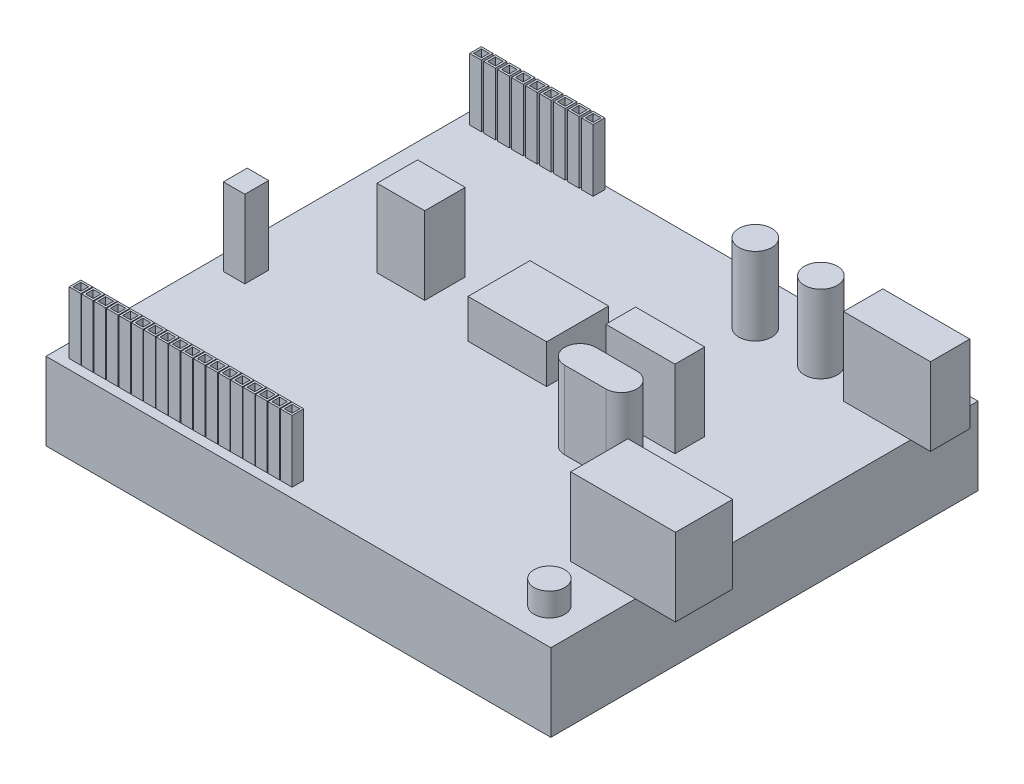
from build123d import *

# Parameters (mm, degrees)
SKETCH1_W           = 65
SKETCH1_H           = 55
BOSS_EXTRUDE1_DEPTH = 10
SKETCH3_W           = 1.5
SKETCH3_H           = 1.5
SKETCH3_W_2         = 1
SKETCH3_H_2         = 1
BOSS_EXTRUDE3_DEPTH = 8
SKETCH5_W           = 1.5
SKETCH5_H           = 1.5
SKETCH5_W_2         = 1
SKETCH5_H_2         = 1
BOSS_EXTRUDE4_DEPTH = 8
SKETCH6_R           = 2.126990432
SKETCH6_W           = 6.136098935
SKETCH6_H           = 5.215684096
SKETCH6_W_2         = 8.897343457
SKETCH6_H_2         = 3.835061835
SKETCH6_W_3         = 13.499417659
SKETCH6_H_3         = 7.363318723
SKETCH6_W_4         = 11.198380558
SKETCH6_H_4         = 5.062281623
SKETCH6_W_5         = 2.761244521
SKETCH6_H_5         = 3.068049468
BOSS_EXTRUDE5_DEPTH = 10
SKETCH7_R           = 1.980205948
BOSS_EXTRUDE6_DEPTH = 3
SKETCH8_W           = 10.124563244
SKETCH8_H           = 7.976928617
BOSS_EXTRUDE7_DEPTH = 5


with BuildPart() as part:
    # Sketch1 → Boss-Extrude1 (new body)
    with BuildSketch(Plane(origin=(0, 0, 0), x_dir=(1, 0, 0), z_dir=(0, 1, 0))):
        Rectangle(SKETCH1_W, SKETCH1_H)
    extrude(amount=BOSS_EXTRUDE1_DEPTH)

    # Sketch3 → Boss-Extrude3 (add)
    # profile 1 of 18: a face of its own
    with BuildSketch(Plane(origin=(0, 10, 0), x_dir=(1, 0, 0), z_dir=(0, 1, 0))):
        with Locations((-30.002126743, -25.514391092)):
            Rectangle(SKETCH3_W, SKETCH3_H)
        with Locations((-30.002126743, -25.514391092)):
            Rectangle(SKETCH3_W_2, SKETCH3_H_2, mode=Mode.SUBTRACT)
    # profile 2 of 18: a face of its own
    with BuildSketch(Plane(origin=(0, 10, 0), x_dir=(1, 0, 0), z_dir=(0, 1, 0))):
        with Locations((-28.402126743, -25.514391092)):
            Rectangle(SKETCH3_W, SKETCH3_H)
        with Locations((-28.402126743, -25.514391092)):
            Rectangle(SKETCH3_W_2, SKETCH3_H_2, mode=Mode.SUBTRACT)
    # profile 3 of 18: a face of its own
    with BuildSketch(Plane(origin=(0, 10, 0), x_dir=(1, 0, 0), z_dir=(0, 1, 0))):
        with Locations((-26.802126743, -25.514391092)):
            Rectangle(SKETCH3_W, SKETCH3_H)
        with Locations((-26.802126743, -25.514391092)):
            Rectangle(SKETCH3_W_2, SKETCH3_H_2, mode=Mode.SUBTRACT)
    # profile 4 of 18: a face of its own
    with BuildSketch(Plane(origin=(0, 10, 0), x_dir=(1, 0, 0), z_dir=(0, 1, 0))):
        with Locations((-25.202126743, -25.514391092)):
            Rectangle(SKETCH3_W, SKETCH3_H)
        with Locations((-25.202126743, -25.514391092)):
            Rectangle(SKETCH3_W_2, SKETCH3_H_2, mode=Mode.SUBTRACT)
    # profile 5 of 18: a face of its own
    with BuildSketch(Plane(origin=(0, 10, 0), x_dir=(1, 0, 0), z_dir=(0, 1, 0))):
        with Locations((-23.602126743, -25.514391092)):
            Rectangle(SKETCH3_W, SKETCH3_H)
        with Locations((-23.602126743, -25.514391092)):
            Rectangle(SKETCH3_W_2, SKETCH3_H_2, mode=Mode.SUBTRACT)
    # profile 6 of 18: a face of its own
    with BuildSketch(Plane(origin=(0, 10, 0), x_dir=(1, 0, 0), z_dir=(0, 1, 0))):
        with Locations((-22.002126743, -25.514391092)):
            Rectangle(SKETCH3_W, SKETCH3_H)
        with Locations((-22.002126743, -25.514391092)):
            Rectangle(SKETCH3_W_2, SKETCH3_H_2, mode=Mode.SUBTRACT)
    # profile 7 of 18: a face of its own
    with BuildSketch(Plane(origin=(0, 10, 0), x_dir=(1, 0, 0), z_dir=(0, 1, 0))):
        with Locations((-20.402126743, -25.514391092)):
            Rectangle(SKETCH3_W, SKETCH3_H)
        with Locations((-20.402126743, -25.514391092)):
            Rectangle(SKETCH3_W_2, SKETCH3_H_2, mode=Mode.SUBTRACT)
    # profile 8 of 18: a face of its own
    with BuildSketch(Plane(origin=(0, 10, 0), x_dir=(1, 0, 0), z_dir=(0, 1, 0))):
        with Locations((-18.802126743, -25.514391092)):
            Rectangle(SKETCH3_W, SKETCH3_H)
        with Locations((-18.802126743, -25.514391092)):
            Rectangle(SKETCH3_W_2, SKETCH3_H_2, mode=Mode.SUBTRACT)
    # profile 9 of 18: a face of its own
    with BuildSketch(Plane(origin=(0, 10, 0), x_dir=(1, 0, 0), z_dir=(0, 1, 0))):
        with Locations((-17.202126743, -25.514391092)):
            Rectangle(SKETCH3_W, SKETCH3_H)
        with Locations((-17.202126743, -25.514391092)):
            Rectangle(SKETCH3_W_2, SKETCH3_H_2, mode=Mode.SUBTRACT)
    # profile 10 of 18: a face of its own
    with BuildSketch(Plane(origin=(0, 10, 0), x_dir=(1, 0, 0), z_dir=(0, 1, 0))):
        with Locations((-15.602126743, -25.514391092)):
            Rectangle(SKETCH3_W, SKETCH3_H)
        with Locations((-15.602126743, -25.514391092)):
            Rectangle(SKETCH3_W_2, SKETCH3_H_2, mode=Mode.SUBTRACT)
    # profile 11 of 18: a face of its own
    with BuildSketch(Plane(origin=(0, 10, 0), x_dir=(1, 0, 0), z_dir=(0, 1, 0))):
        with Locations((-14.002126743, -25.514391092)):
            Rectangle(SKETCH3_W, SKETCH3_H)
        with Locations((-14.002126743, -25.514391092)):
            Rectangle(SKETCH3_W_2, SKETCH3_H_2, mode=Mode.SUBTRACT)
    # profile 12 of 18: a face of its own
    with BuildSketch(Plane(origin=(0, 10, 0), x_dir=(1, 0, 0), z_dir=(0, 1, 0))):
        with Locations((-12.402126743, -25.514391092)):
            Rectangle(SKETCH3_W, SKETCH3_H)
        with Locations((-12.402126743, -25.514391092)):
            Rectangle(SKETCH3_W_2, SKETCH3_H_2, mode=Mode.SUBTRACT)
    # profile 13 of 18: a face of its own
    with BuildSketch(Plane(origin=(0, 10, 0), x_dir=(1, 0, 0), z_dir=(0, 1, 0))):
        with Locations((-10.802126743, -25.514391092)):
            Rectangle(SKETCH3_W, SKETCH3_H)
        with Locations((-10.802126743, -25.514391092)):
            Rectangle(SKETCH3_W_2, SKETCH3_H_2, mode=Mode.SUBTRACT)
    # profile 14 of 18: a face of its own
    with BuildSketch(Plane(origin=(0, 10, 0), x_dir=(1, 0, 0), z_dir=(0, 1, 0))):
        with Locations((-9.202126743, -25.514391092)):
            Rectangle(SKETCH3_W, SKETCH3_H)
        with Locations((-9.202126743, -25.514391092)):
            Rectangle(SKETCH3_W_2, SKETCH3_H_2, mode=Mode.SUBTRACT)
    # profile 15 of 18: a face of its own
    with BuildSketch(Plane(origin=(0, 10, 0), x_dir=(1, 0, 0), z_dir=(0, 1, 0))):
        with Locations((-7.602126743, -25.514391092)):
            Rectangle(SKETCH3_W, SKETCH3_H)
        with Locations((-7.602126743, -25.514391092)):
            Rectangle(SKETCH3_W_2, SKETCH3_H_2, mode=Mode.SUBTRACT)
    # profile 16 of 18: a face of its own
    with BuildSketch(Plane(origin=(0, 10, 0), x_dir=(1, 0, 0), z_dir=(0, 1, 0))):
        with Locations((-6.002126743, -25.514391092)):
            Rectangle(SKETCH3_W, SKETCH3_H)
        with Locations((-6.002126743, -25.514391092)):
            Rectangle(SKETCH3_W_2, SKETCH3_H_2, mode=Mode.SUBTRACT)
    # profile 17 of 18: a face of its own
    with BuildSketch(Plane(origin=(0, 10, 0), x_dir=(1, 0, 0), z_dir=(0, 1, 0))):
        with Locations((-4.402126743, -25.514391092)):
            Rectangle(SKETCH3_W, SKETCH3_H)
        with Locations((-4.402126743, -25.514391092)):
            Rectangle(SKETCH3_W_2, SKETCH3_H_2, mode=Mode.SUBTRACT)
    # profile 18 of 18: a face of its own
    with BuildSketch(Plane(origin=(0, 10, 0), x_dir=(1, 0, 0), z_dir=(0, 1, 0))):
        with Locations((-2.802126743, -25.514391092)):
            Rectangle(SKETCH3_W, SKETCH3_H)
        with Locations((-2.802126743, -25.514391092)):
            Rectangle(SKETCH3_W_2, SKETCH3_H_2, mode=Mode.SUBTRACT)
    extrude(amount=BOSS_EXTRUDE3_DEPTH)

    # Sketch5 → Boss-Extrude4 (add)
    # profile 1 of 9: a face of its own
    with BuildSketch(Plane(origin=(0, 10, 0), x_dir=(1, 0, 0), z_dir=(0, 1, 0))):
        with Locations((-28.452087774, 26.300898691)):
            Rectangle(SKETCH5_W, SKETCH5_H)
        with Locations((-28.452087774, 26.300898691)):
            Rectangle(SKETCH5_W_2, SKETCH5_H_2, mode=Mode.SUBTRACT)
    # profile 2 of 9: a face of its own
    with BuildSketch(Plane(origin=(0, 10, 0), x_dir=(1, 0, 0), z_dir=(0, 1, 0))):
        with Locations((-30.252087774, 26.300898691)):
            Rectangle(SKETCH5_W, SKETCH5_H)
        with Locations((-30.252087774, 26.300898691)):
            Rectangle(SKETCH5_W_2, SKETCH5_H_2, mode=Mode.SUBTRACT)
    # profile 3 of 9: a face of its own
    with BuildSketch(Plane(origin=(0, 10, 0), x_dir=(1, 0, 0), z_dir=(0, 1, 0))):
        with Locations((-26.652087774, 26.300898691)):
            Rectangle(SKETCH5_W, SKETCH5_H)
        with Locations((-26.652087774, 26.300898691)):
            Rectangle(SKETCH5_W_2, SKETCH5_H_2, mode=Mode.SUBTRACT)
    # profile 4 of 9: a face of its own
    with BuildSketch(Plane(origin=(0, 10, 0), x_dir=(1, 0, 0), z_dir=(0, 1, 0))):
        with Locations((-24.852087774, 26.300898691)):
            Rectangle(SKETCH5_W, SKETCH5_H)
        with Locations((-24.852087774, 26.300898691)):
            Rectangle(SKETCH5_W_2, SKETCH5_H_2, mode=Mode.SUBTRACT)
    # profile 5 of 9: a face of its own
    with BuildSketch(Plane(origin=(0, 10, 0), x_dir=(1, 0, 0), z_dir=(0, 1, 0))):
        with Locations((-23.052087774, 26.300898691)):
            Rectangle(SKETCH5_W, SKETCH5_H)
        with Locations((-23.052087774, 26.300898691)):
            Rectangle(SKETCH5_W_2, SKETCH5_H_2, mode=Mode.SUBTRACT)
    # profile 6 of 9: a face of its own
    with BuildSketch(Plane(origin=(0, 10, 0), x_dir=(1, 0, 0), z_dir=(0, 1, 0))):
        with Locations((-21.252087774, 26.300898691)):
            Rectangle(SKETCH5_W, SKETCH5_H)
        with Locations((-21.252087774, 26.300898691)):
            Rectangle(SKETCH5_W_2, SKETCH5_H_2, mode=Mode.SUBTRACT)
    # profile 7 of 9: a face of its own
    with BuildSketch(Plane(origin=(0, 10, 0), x_dir=(1, 0, 0), z_dir=(0, 1, 0))):
        with Locations((-19.452087774, 26.300898691)):
            Rectangle(SKETCH5_W, SKETCH5_H)
        with Locations((-19.452087774, 26.300898691)):
            Rectangle(SKETCH5_W_2, SKETCH5_H_2, mode=Mode.SUBTRACT)
    # profile 8 of 9: a face of its own
    with BuildSketch(Plane(origin=(0, 10, 0), x_dir=(1, 0, 0), z_dir=(0, 1, 0))):
        with Locations((-17.652087774, 26.300898691)):
            Rectangle(SKETCH5_W, SKETCH5_H)
        with Locations((-17.652087774, 26.300898691)):
            Rectangle(SKETCH5_W_2, SKETCH5_H_2, mode=Mode.SUBTRACT)
    # profile 9 of 9: a face of its own
    with BuildSketch(Plane(origin=(0, 10, 0), x_dir=(1, 0, 0), z_dir=(0, 1, 0))):
        with Locations((-15.852087774, 26.300898691)):
            Rectangle(SKETCH5_W, SKETCH5_H)
        with Locations((-15.852087774, 26.300898691)):
            Rectangle(SKETCH5_W_2, SKETCH5_H_2, mode=Mode.SUBTRACT)
    extrude(amount=BOSS_EXTRUDE4_DEPTH)

    # Sketch6 → Boss-Extrude5 (add)
    with BuildSketch(Plane(origin=(0, 10, 0), x_dir=(1, 0, 0), z_dir=(0, 1, 0))):
        with Locations(Location((9.971160771, 21.361294421, 0), (0, 0, 270))):
            Circle(SKETCH6_R)
        with Locations(Location((18.408296808, 21.361294421, 0), (0, 0, 270))):
            Circle(SKETCH6_R)
        with Locations((-17.41118073, 5.714242134)):
            Rectangle(SKETCH6_W, SKETCH6_H)
        with Locations((14.4198325, 4.026814927)):
            Rectangle(SKETCH6_W_2, SKETCH6_H_2)
        with Locations((30.91059839, -12.924158384)):
            Rectangle(SKETCH6_W_3, SKETCH6_H_3)
        with Locations((29.453274892, 21.361294421)):
            Rectangle(SKETCH6_W_4, SKETCH6_H_4)
        with BuildLine():
            Line((11.888691688, -1.112167932), (17.18107702, -1.112167932))
            ThreePointArc((17.18107702, -1.112167932), (19.175309175, -3.106400086), (17.18107702, -5.10063224))
            Line((17.18107702, -5.10063224), (11.888691688, -5.10063224))
            ThreePointArc((11.888691688, -5.10063224), (9.894459534, -3.106400086), (11.888691688, -1.112167932))
        make_face()
        with Locations((-29.146469946, -5.10063224)):
            Rectangle(SKETCH6_W_5, SKETCH6_H_5)
    extrude(amount=BOSS_EXTRUDE5_DEPTH)

    # Sketch7 → Boss-Extrude6 (add)
    with BuildSketch(Plane(origin=(0, 10, 0), x_dir=(1, 0, 0), z_dir=(0, 1, 0))):
        with Locations(Location((27.700352794, -22.881151475, 0), (0, 0, 270))):
            Circle(SKETCH7_R)
    extrude(amount=BOSS_EXTRUDE6_DEPTH)

    # Sketch8 → Boss-Extrude7 (add)
    with BuildSketch(Plane(origin=(0, 10, 0), x_dir=(1, 0, 0), z_dir=(0, 1, 0))):
        with Locations((-1.945219356, 5.330735951)):
            Rectangle(SKETCH8_W, SKETCH8_H)
    extrude(amount=BOSS_EXTRUDE7_DEPTH)


solid = part.part
